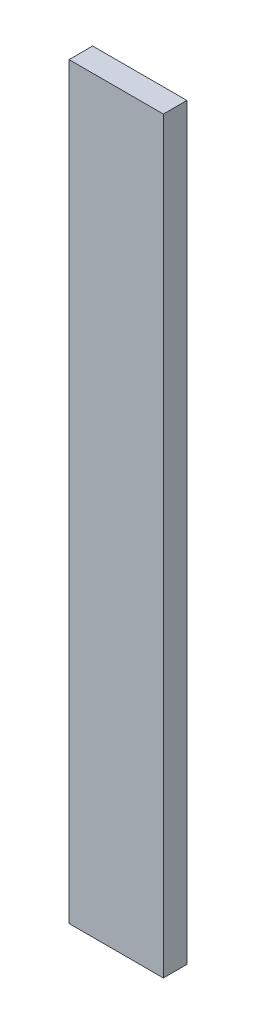
from build123d import *

# Parameters (mm, degrees)
SKETCH1_W           = 0.8001
SKETCH1_H           = 6.35
BOSS_EXTRUDE1_DEPTH = 0.2


with BuildPart() as part:
    # Sketch1 → Boss-Extrude1 (new body)
    with BuildSketch(Plane.XY):
        with Locations((0.40005, 3.175)):
            Rectangle(SKETCH1_W, SKETCH1_H)
    extrude(amount=BOSS_EXTRUDE1_DEPTH)


solid = part.part
